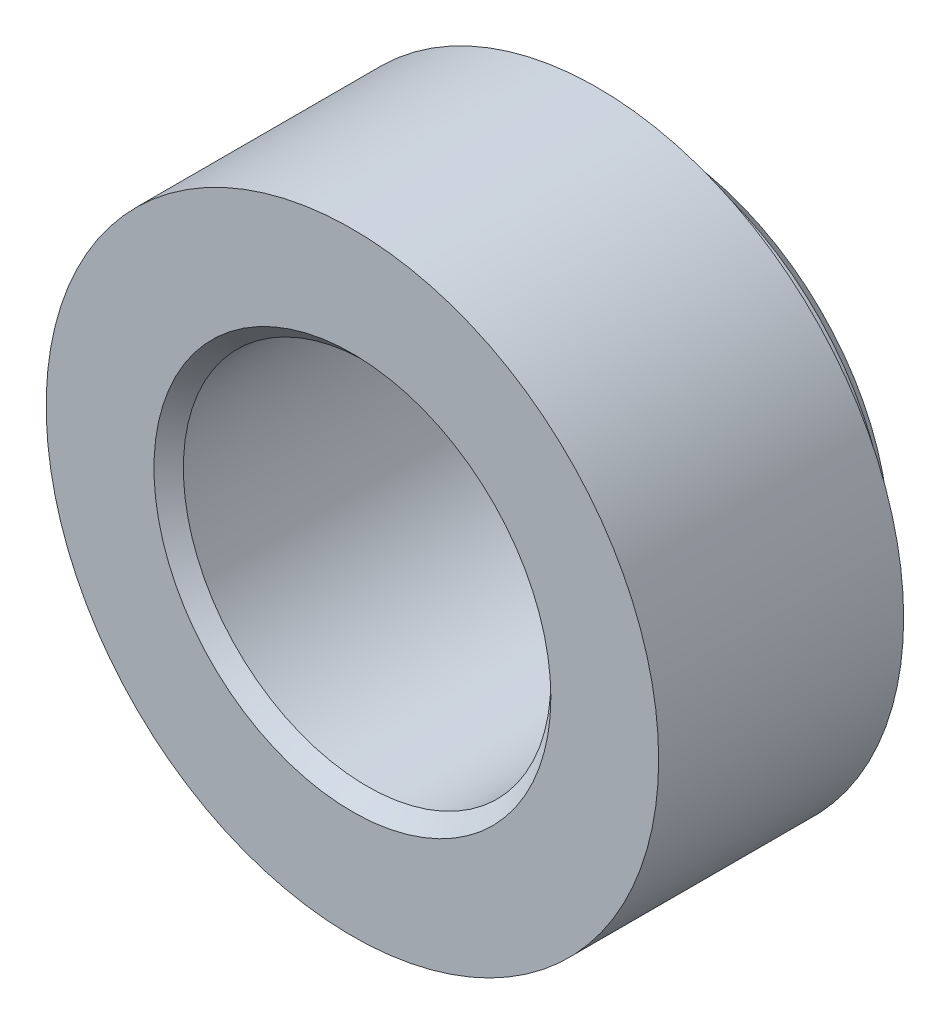
from build123d import *


with BuildPart() as part:
    # Sketch1 → Revolve1 (revolve)
    with BuildSketch(Plane(origin=(0, 0, 0), x_dir=(0, 0, -1), z_dir=(1, 0, 0)), mode=Mode.PRIVATE) as revolve1_sk:
        Polygon((0, 31.75), (0, 20.574), (1.524, 19.05), (31.75, 19.05), (31.75, 23.876), (30.226, 25.4), (25.4, 25.4), (25.4, 31.75), align=None)
    revolve(revolve1_sk.sketch.rotate(Axis((0, 0, 0), (0, 0, -1)), 90), axis=Axis((0, 0, 0), (0, 0, -1)))


solid = part.part
